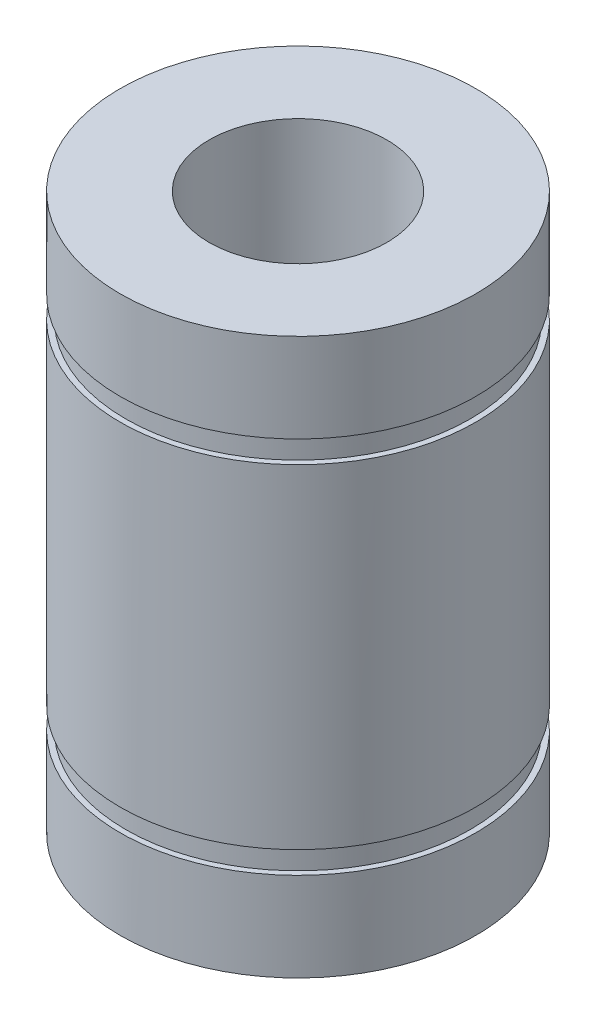
from build123d import *

# Parameters (mm, degrees)
SKETCH1_R           = 8
SKETCH1_R_2         = 4
BOSS_EXTRUDE1_DEPTH = 25
SKETCH2_W           = 1.25
SKETCH2_H           = 1


with BuildPart() as part:
    # Sketch1 → Boss-Extrude1 (new body)
    with BuildSketch(Plane(origin=(0, 0, 0), x_dir=(1, 0, 0), z_dir=(0, 1, 0))):
        with Locations(Location((0, 0, 0), (0, 0, 270))):
            Circle(SKETCH1_R)
        with Locations(Location((0, 0, 0), (0, 0, 270))):
            Circle(SKETCH1_R_2, mode=Mode.SUBTRACT)
    extrude(amount=BOSS_EXTRUDE1_DEPTH)

    # Sketch2 → Cut-Revolve1 (revolve, cut)
    with BuildSketch(Plane.XY, mode=Mode.PRIVATE) as cut_revolve1_sk:
        with Locations((-8.375, 20.5)):
            Rectangle(SKETCH2_W, SKETCH2_H)
        with Locations((-8.375, 4.5)):
            Rectangle(SKETCH2_W, SKETCH2_H)
    revolve(cut_revolve1_sk.sketch.rotate(Axis((0, 25, 0), (0, -1, 0)), 270), axis=Axis((0, 25, 0), (0, -1, 0)), mode=Mode.SUBTRACT)


solid = part.part
